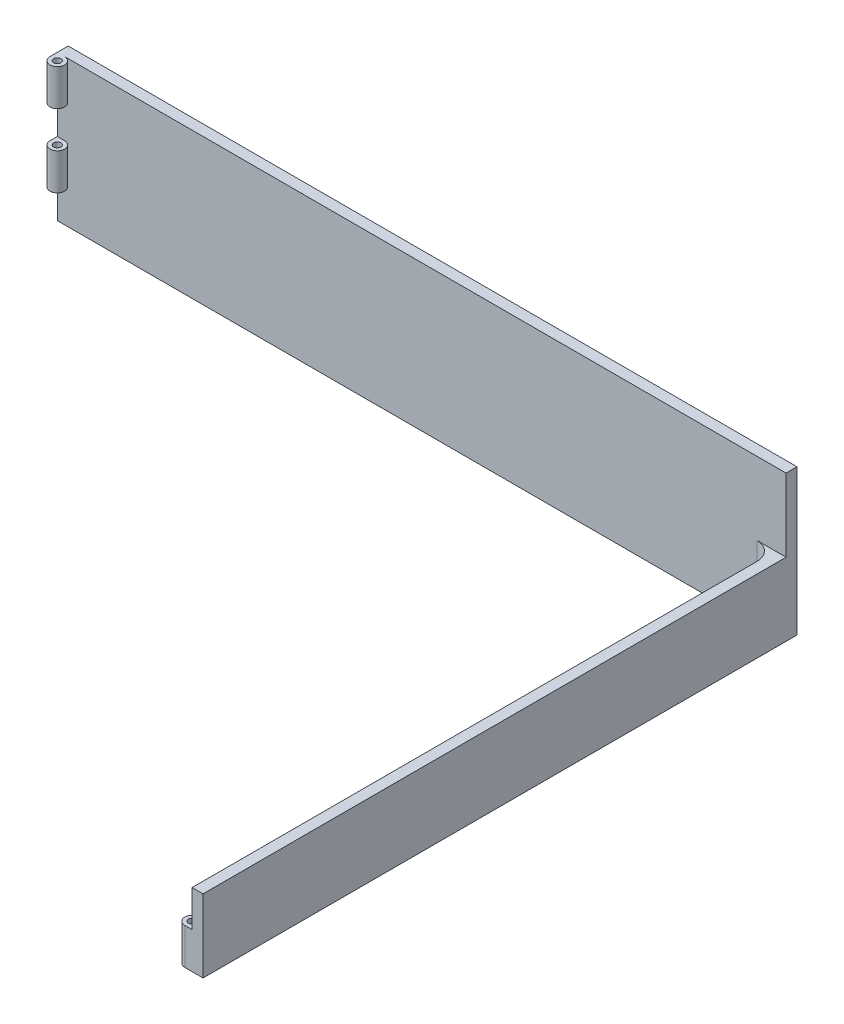
from build123d import *

# Parameters (mm, degrees)
SKETCH1_W           = 200
SKETCH1_H           = 40
BOSS_EXTRUDE1_DEPTH = 3
SKETCH2_W           = 160
SKETCH2_H           = 20
BOSS_EXTRUDE2_DEPTH = 3
FILLET1_R           = 5
SKETCH3_R           = 1
BOSS_EXTRUDE3_DEPTH = 10
LPATTERN1_COUNT     = 2
LPATTERN1_PITCH     = 20
SKETCH4_R           = 1
BOSS_EXTRUDE4_DEPTH = 10


with BuildPart() as part:
    # Sketch1 → Boss-Extrude1 (new body)
    with BuildSketch(Plane.XY):
        with Locations((-53.405017921, -13.512544803)):
            Rectangle(SKETCH1_W, SKETCH1_H)
    extrude(amount=BOSS_EXTRUDE1_DEPTH)

    # Sketch2 → Boss-Extrude2 (add)
    with BuildSketch(Plane(origin=(46.594982079, 0, 0), x_dir=(0, 0, -1), z_dir=(1, 0, 0))):
        with Locations((-83, -23.512544803)):
            Rectangle(SKETCH2_W, SKETCH2_H)
    extrude(amount=-BOSS_EXTRUDE2_DEPTH)

    # Fillet1
    fillet1_edges = [part.edges().sort_by_distance(p)[0] for p in [
        (43.594982079, -23.512544803, 3),
    ]]
    fillet(fillet1_edges, radius=FILLET1_R)

    # Sketch3 → Boss-Extrude3 (add)
    with BuildSketch(Plane(origin=(0, 6.487455197, 0), x_dir=(1, 0, 0), z_dir=(0, 1, 0))):
        with BuildLine():
            Line((-153.405017921, -3), (-153.405017921, -5))
            ThreePointArc((-153.405017921, -5), (-149.990804359, -6.414213562), (-151.405017921, -3))
            Line((-151.405017921, -3), (-153.405017921, -3))
        make_face()
        with Locations(Location((-151.405017921, -5, 0), (0, 0, 270))):
            Circle(SKETCH3_R, mode=Mode.SUBTRACT)
    boss_extrude3 = extrude(amount=-BOSS_EXTRUDE3_DEPTH)

    # LPattern1: Boss-Extrude3 ×2
    with Locations(*[(0, -i * LPATTERN1_PITCH, 0) for i in range(1, LPATTERN1_COUNT)]):
        add(boss_extrude3)

    # Sketch4 → Boss-Extrude4 (add)
    with BuildSketch(Plane.XZ.offset(33.512544803)):
        with BuildLine():
            Line((43.594982079, 163), (41.594982079, 163))
            ThreePointArc((41.594982079, 163), (40.180768516, 159.585786438), (43.594982079, 161))
            Line((43.594982079, 161), (43.594982079, 163))
        make_face()
        with Locations(Location((41.594982079, 161, 0), (0, 0, 270))):
            Circle(SKETCH4_R, mode=Mode.SUBTRACT)
    extrude(amount=-BOSS_EXTRUDE4_DEPTH)


solid = part.part
